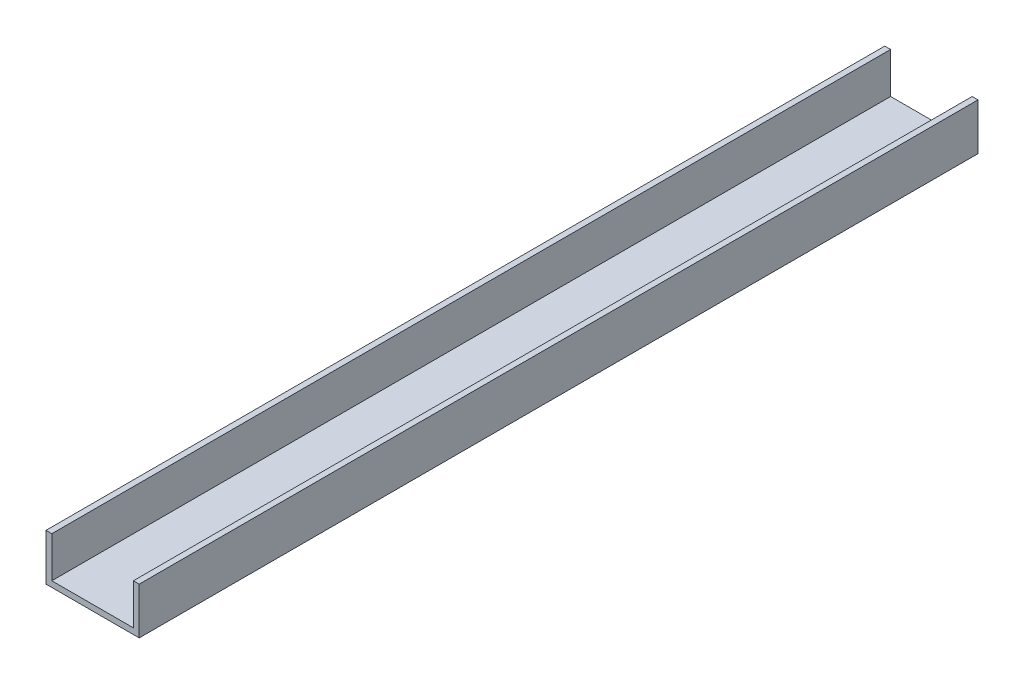
from build123d import *

# Parameters (mm, degrees)
BOSS_EXTRUDE1_DEPTH = 457.2


with BuildPart() as part:
    # Sketch1 → Boss-Extrude1 (new body)
    with BuildSketch(Plane.XY):
        Polygon((3.175, 3.175), (3.175, 25.4), (0, 25.4), (0, 0), (50.8, 0), (50.8, 25.4), (47.625, 25.4), (47.625, 3.175), align=None)
    extrude(amount=BOSS_EXTRUDE1_DEPTH)


solid = part.part
